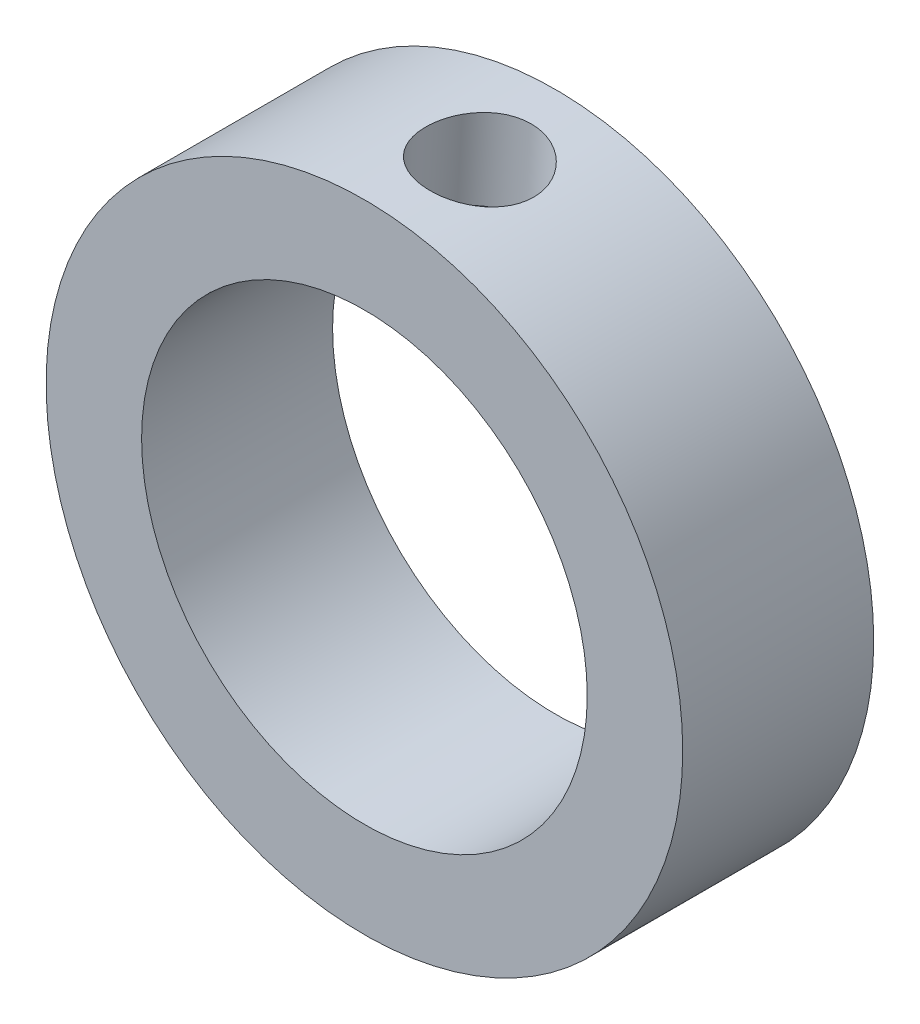
from build123d import *

# Parameters (mm, degrees)
SKETCH_1_R                   = 25
SKETCH_1_R_2                 = 17.5
EXTRUDE_1_DEPTH              = 15
HOLE_WIZARD_M102_D           = 8.5
HOLE_WIZARD_M102_DEPTH       = 24.946342369
HOLE_WIZARD_M102_CSINK_D     = 10.05
HOLE_WIZARD_M102_CSINK_ANGLE = 90
HOLE_WIZARD_M102_TIP         = 2.553657631


with BuildPart() as part:
    # Эскиз1 → Бобышка-Вытянуть1 (new body)
    with BuildSketch(Plane.XY):
        Circle(SKETCH_1_R)
        Circle(SKETCH_1_R_2, mode=Mode.SUBTRACT)
    extrude(amount=EXTRUDE_1_DEPTH)

    # Отверстие обработанное метчиком M102
    with Locations(Plane(origin=(1.106433423, 17.464987978, 7.5), x_dir=(-0.997999313042, 0.063224767047, 0), z_dir=(-0.063224767047, -0.997999313042, 0))):
        with Locations((0, 0)):
            CounterSinkHole(HOLE_WIZARD_M102_D / 2, HOLE_WIZARD_M102_CSINK_D / 2, depth=HOLE_WIZARD_M102_DEPTH, counter_sink_angle=HOLE_WIZARD_M102_CSINK_ANGLE)
            with Locations((0, 0, -(HOLE_WIZARD_M102_DEPTH + HOLE_WIZARD_M102_TIP / 2))):  # 118° drill point
                Cone(0, HOLE_WIZARD_M102_D / 2, HOLE_WIZARD_M102_TIP, mode=Mode.SUBTRACT)


solid = part.part
